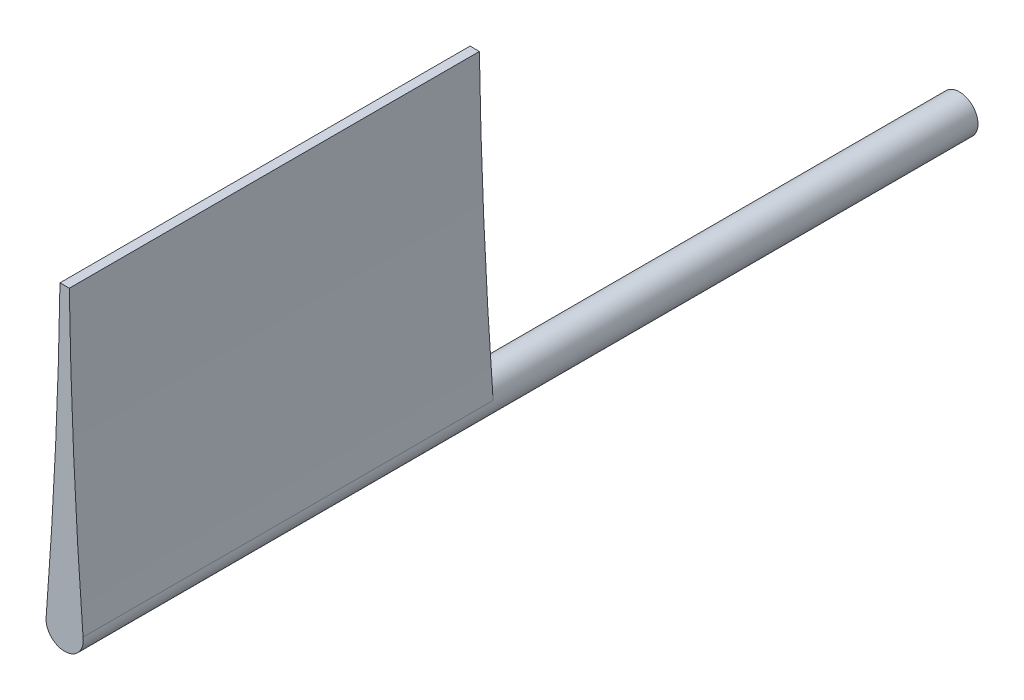
from build123d import *
from build123d.topology import SkipClean

# Parameters (mm, degrees)
SKETCH4_R           = 5
BOSS_EXTRUDE1_DEPTH = 130
BOSS_EXTRUDE2_START = 110
SKETCH5_R           = 5
BOSS_EXTRUDE2_DEPTH = 110


with BuildPart() as part:
    # Sketch1 → Loft1 section 0
    with BuildSketch(Plane(origin=(0, 0, 0), x_dir=(1, 0, 0), z_dir=(0, 1, 0))):
        with BuildLine():
            Line((0, 25.606060606), (-10, 25.606060606))
            Line((-10, 25.606060606), (-10, -84.393939394))
            Line((-10, -84.393939394), (0, -84.393939394))
            Line((0, -84.393939394), (0, 25.606060606))
        make_face()
    # Sketch2 → Loft1 section 1
    with BuildSketch(Plane(origin=(0, 40, 0), x_dir=(1, 0, 0), z_dir=(0, 1, 0))):
        with BuildLine():
            Line((-2.5, 25.606060606), (-2.5, -84.393939394))
            Line((-2.5, -84.393939394), (-7.5, -84.393939394))
            Line((-7.5, -84.393939394), (-7.5, 25.606060606))
            Line((-7.5, 25.606060606), (-2.5, 25.606060606))
        make_face()
    # Sketch3 → Loft1 section 2
    with BuildSketch(Plane(origin=(0, 80, 0), x_dir=(1, 0, 0), z_dir=(0, 1, 0))):
        with BuildLine():
            Line((-6.25, 25.606060606), (-3.75, 25.606060606))
            Line((-3.75, 25.606060606), (-3.75, -84.393939394))
            Line((-3.75, -84.393939394), (-6.25, -84.393939394))
            Line((-6.25, -84.393939394), (-6.25, 25.606060606))
        make_face()
    loft()

    # Sketch4 → Boss-Extrude1 (add)
    with BuildSketch(Plane(origin=(0, 0, -25.606060606), x_dir=(-1, 0, 0), z_dir=(0, 0, -1))):
        with Locations((5, 0)):
            Circle(SKETCH4_R)
    extrude(amount=BOSS_EXTRUDE1_DEPTH)

    # Sketch5 → Boss-Extrude2 (add)
    with SkipClean():  # the faces are left unmerged after this step: merging them gives an invalid solid
        with BuildSketch(Plane.XY.offset(-25.606060606).offset(BOSS_EXTRUDE2_START)):
            with Locations(Location((-5, 0, 0), (0, 0, 8.902401969))):
                Circle(SKETCH5_R)
        extrude(amount=-BOSS_EXTRUDE2_DEPTH)


solid = part.part
